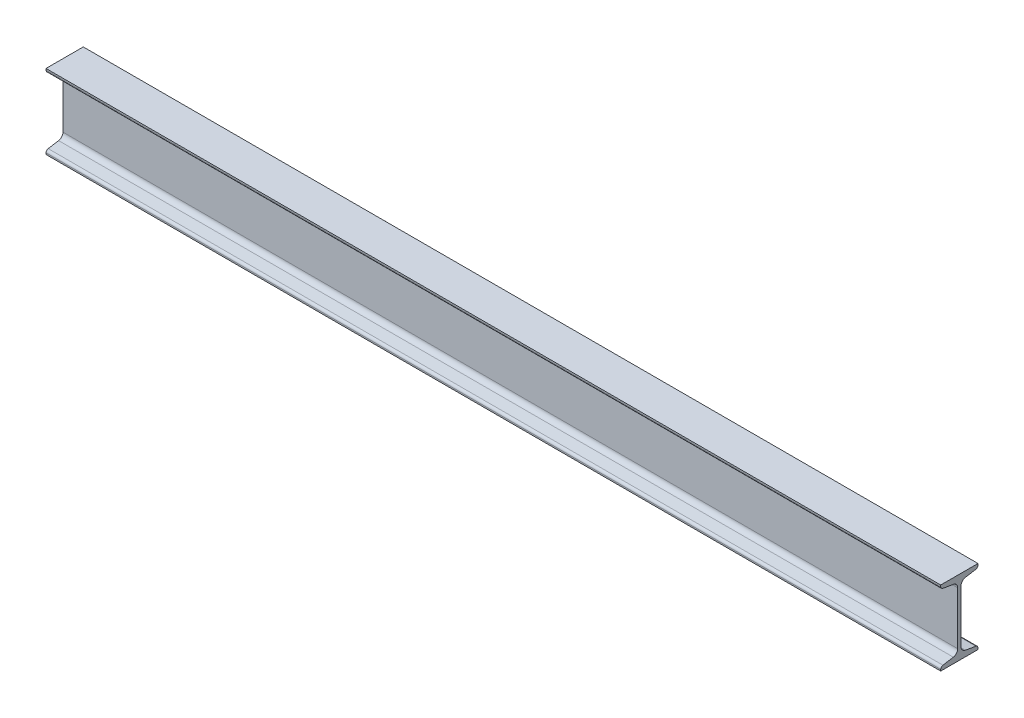
from build123d import *

# Parameters (mm, degrees)
SB_BEAM_100_X_8_1_DEPTH = 1200


with BuildPart() as part:
    # Sketch11 → Sb beam 100 X 8(1) (new body)
    with BuildSketch(Plane(origin=(0, 0, 0), x_dir=(0, 0, -1), z_dir=(1, 0, 0))):
        with BuildLine():
            Line((-25, -50), (-25, -48.060671023))
            ThreePointArc((-25, -48.060671023), (-24.17058332, -45.798374682), (-22.075437296, -44.608299096))
            Line((-22.075437296, -44.608299096), (-8.099125408, -42.278743853))
            ThreePointArc((-8.099125408, -42.278743853), (-3.90883336, -39.898592681), (-2.25, -35.374))
            Line((-2.25, -35.374), (-2.25, 35.374))
            ThreePointArc((-2.25, 35.374), (-3.90883336, 39.898592681), (-8.099125408, 42.278743853))
            Line((-8.099125408, 42.278743853), (-22.075437296, 44.608299096))
            ThreePointArc((-22.075437296, 44.608299096), (-24.17058332, 45.798374682), (-25, 48.060671023))
            Line((-25, 48.060671023), (-25, 50))
            Line((-25, 50), (25, 50))
            Line((25, 50), (25, 48.060671023))
            ThreePointArc((25, 48.060671023), (24.17058332, 45.798374682), (22.075437296, 44.608299096))
            Line((22.075437296, 44.608299096), (8.099125408, 42.278743853))
            ThreePointArc((8.099125408, 42.278743853), (3.90883336, 39.898592681), (2.25, 35.374))
            Line((2.25, 35.374), (2.25, -35.374))
            ThreePointArc((2.25, -35.374), (3.90883336, -39.898592681), (8.099125408, -42.278743853))
            Line((8.099125408, -42.278743853), (22.075437296, -44.608299096))
            ThreePointArc((22.075437296, -44.608299096), (24.17058332, -45.798374682), (25, -48.060671023))
            Line((25, -48.060671023), (25, -50))
            Line((25, -50), (-25, -50))
        make_face()
    extrude(amount=SB_BEAM_100_X_8_1_DEPTH)


solid = part.part
